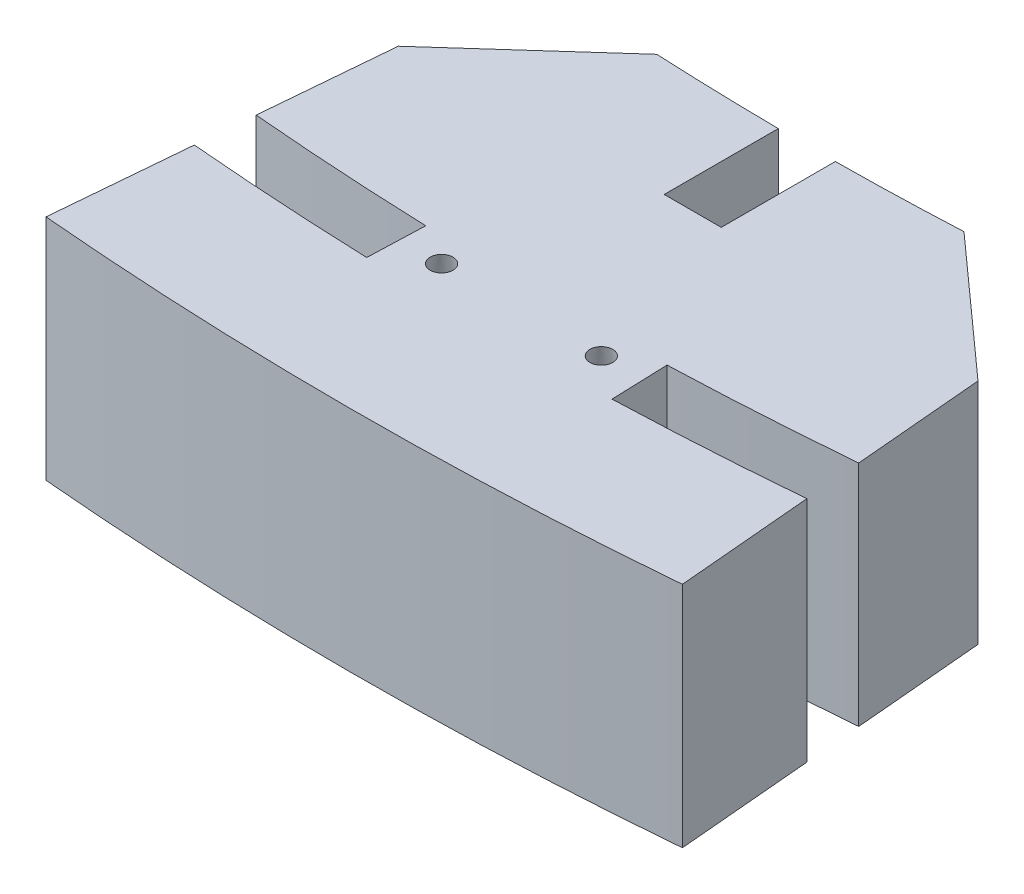
from build123d import *

# Parameters (mm, degrees)
EXTRUDE_1_DEPTH         = 100
CUT_EXTRUDE_2_DEPTH     = 1610.175588972
CUT_EXTRUDE_7_DEPTH     = 1610.175588972
HOLE_WIZARD_M6_1_REACH  = 1611.176
HOLE_WIZARD_M6_1_BORE_R = 2.5
CUT_EXTRUDE_8_REACH     = 1611.176


with BuildPart() as part:
    # 草图3 → 凸台-拉伸1 (new body)
    with BuildSketch(Plane(origin=(0, 0, 0), x_dir=(1, 0, 0), z_dir=(0, 1, 0))):
        with BuildLine():
            Line((-139.449188396, -1593.911516947), (-122.018039847, -1394.672577328))
            ThreePointArc((-122.018039847, -1394.672577328), (0, -1400), (122.018039847, -1394.672577328))
            Line((122.018039847, -1394.672577328), (139.449188396, -1593.911516947))
            ThreePointArc((139.449188396, -1593.911516947), (0, -1600), (-139.449188396, -1593.911516947))
        make_face()
    extrude(amount=EXTRUDE_1_DEPTH)

    # 草图6 → 切除-拉伸2 (cut, through all)
    with BuildSketch(Plane(origin=(0, 100, 0), x_dir=(1, 0, 0), z_dir=(0, 1, 0))):
        Polygon((-12.5, -1399.944195316), (12.5, -1399.944195316), (12.5, -1449.944195316), (0, -1449.944195316), (-12.5, -1449.944195316), align=None)
    extrude(amount=-CUT_EXTRUDE_2_DEPTH, mode=Mode.SUBTRACT)

    # 草图8 → 切除-旋转1 (revolve, cut)
    with BuildSketch(Plane(origin=(-35, 0, 0), x_dir=(0, 0, -1), z_dir=(1, 0, 0)), mode=Mode.PRIVATE) as cut_revolve_1_sk:
        Polygon((-1525, 100), (-1530, 100), (-1538.682408883, 50.759612349), (-1538.682408883, 0), (-1525, 0), align=None)
    cut_revolve_1 = revolve(cut_revolve_1_sk.sketch.rotate(Axis((-35, 0, 1525), (0, 1, 0)), 180), axis=Axis((-35, 0, 1525), (0, 1, 0)), mode=Mode.SUBTRACT)

    # 镜向1: 切除-旋转1 across plane
    add(cut_revolve_1.mirror(Plane.ZY), mode=Mode.SUBTRACT)

    # 草图10 → 切除-拉伸7 (cut, through all)
    with BuildSketch(Plane.XZ):
        with BuildLine():
            Line((-134.219843831, 1534.139835061), (-132.040950263, 1509.234967609))
            ThreePointArc((-132.040950263, 1509.234967609), (-92.488537395, 1512.174219609), (-52.872737504, 1514.077102934))
            Line((-52.872737504, 1514.077102934), (-53.745224922, 1539.061873609))
            ThreePointArc((-53.745224922, 1539.061873609), (-94.014750884, 1537.12758957), (-134.219843831, 1534.139835061))
        make_face()
        with BuildLine():
            Line((53.745224922, 1539.061873609), (52.872737504, 1514.077102934))
            ThreePointArc((52.872737504, 1514.077102934), (92.488537395, 1512.174219609), (132.040950263, 1509.234967609))
            Line((132.040950263, 1509.234967609), (134.219843831, 1534.139835061))
            ThreePointArc((134.219843831, 1534.139835061), (94.014750884, 1537.12758957), (53.745224922, 1539.061873609))
        make_face()
    extrude(amount=-CUT_EXTRUDE_7_DEPTH, mode=Mode.SUBTRACT)

    # M6 螺纹孔的螺纹孔钻头1 bore → M6 螺纹孔的螺纹孔钻头1 (cut, up to next)
    with BuildSketch(Plane(origin=(0, 0, 0), x_dir=(-0.0348994967024942, 0, 0.999390827019096), z_dir=(-0.999390827019096, 0, -0.0348994967024942)), mode=Mode.PRIVATE) as hole_wizard_m6_1_sk1:
        with Locations((1526.5, 40)):
            Circle(HOLE_WIZARD_M6_1_BORE_R)
    hole_wizard_m6_1_tool1 = extrude(hole_wizard_m6_1_sk1.sketch, amount=-HOLE_WIZARD_M6_1_REACH, mode=Mode.PRIVATE) & part.part
    hole_wizard_m6_1 = hole_wizard_m6_1_tool1.solids().sort_by_distance((-53.274082, 40, 1525.570097))[0]
    add(hole_wizard_m6_1, mode=Mode.SUBTRACT)

    # 镜向2: M6 螺纹孔的螺纹孔钻头1 across plane
    add(hole_wizard_m6_1.mirror(Plane.ZY), mode=Mode.SUBTRACT)

    # 草图14 → 切除-拉伸8 (cut, up to next)
    with BuildSketch(Plane.XZ, mode=Mode.PRIVATE) as cut_extrude_8_sk1:
        with BuildLine():
            Line((127.029495055, 1451.953772469), (67.310647375, 1398.380948365))
            ThreePointArc((67.310647375, 1398.380948365), (94.682500787, 1396.794624862), (122.018039847, 1394.672577328))
            Line((122.018039847, 1394.672577328), (127.029495055, 1451.953772469))
        make_face()
    cut_extrude_8_tool1 = extrude(cut_extrude_8_sk1.sketch, amount=-CUT_EXTRUDE_8_REACH, mode=Mode.PRIVATE) & part.part
    # 草图14 → 切除-拉伸8 (cut, up to next)
    with BuildSketch(Plane.XZ, mode=Mode.PRIVATE) as cut_extrude_8_sk2:
        with BuildLine():
            Line((-127.029495055, 1451.953772469), (-122.018039847, 1394.672577328))
            ThreePointArc((-122.018039847, 1394.672577328), (-94.682500787, 1396.794624862), (-67.310647375, 1398.380948365))
            Line((-67.310647375, 1398.380948365), (-127.029495055, 1451.953772469))
        make_face()
    cut_extrude_8_tool2 = extrude(cut_extrude_8_sk2.sketch, amount=-CUT_EXTRUDE_8_REACH, mode=Mode.PRIVATE) & part.part
    add(cut_extrude_8_tool1.solids().sort_by_distance((105.520281, 0, 1415.117528))[0], mode=Mode.SUBTRACT)
    add(cut_extrude_8_tool2.solids().sort_by_distance((-105.520281, 0, 1415.117528))[0], mode=Mode.SUBTRACT)


solid = part.part
